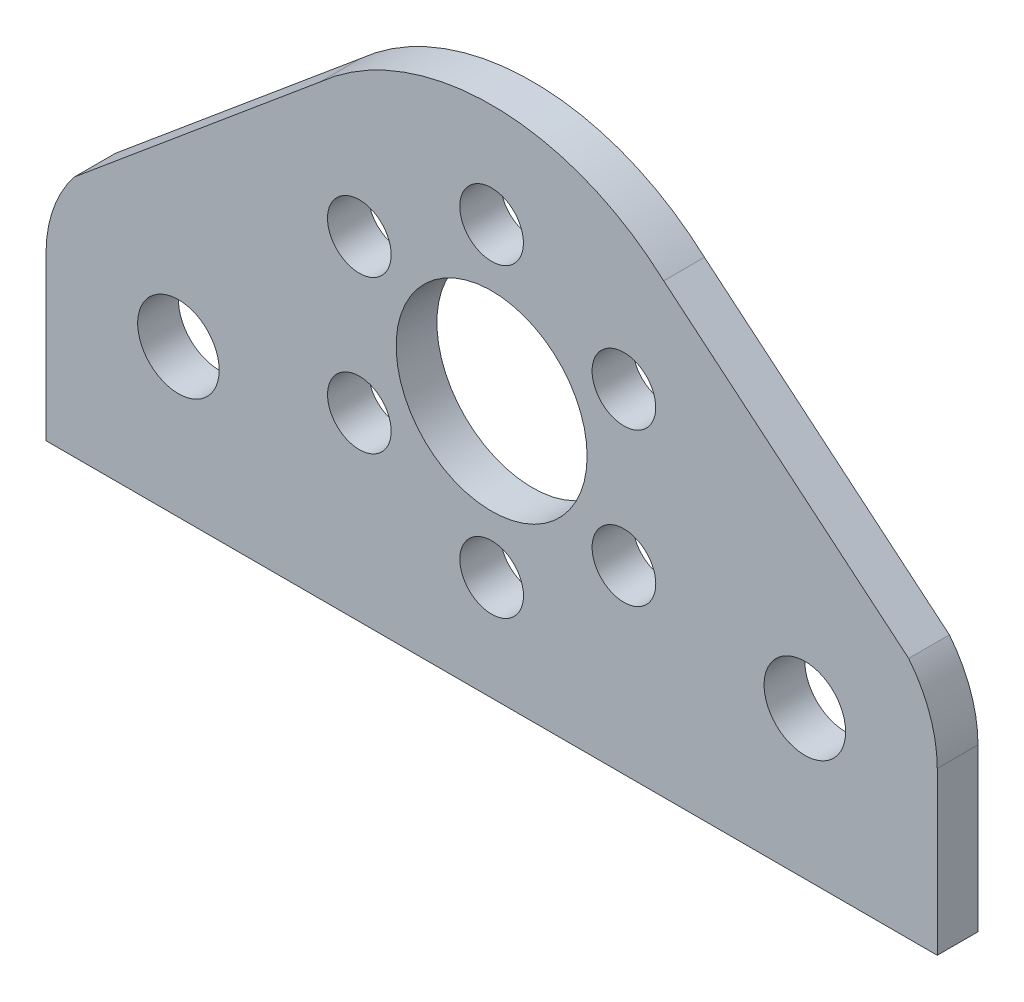
from build123d import *

# Parameters (mm, degrees)
CROQUIS1_R              = 3.75
CROQUIS1_R_2            = 1.249999997
CROQUIS1_R_3            = 1.25
CROQUIS1_R_4            = 1.250000007
CROQUIS1_R_5            = 1.6
SALIENTE_EXTRUIR1_DEPTH = 1.6


with BuildPart() as part:
    # Croquis1 → Saliente-Extruir1 (new body)
    with BuildSketch(Plane.XY):
        with BuildLine():
            Line((-17.5, -10.1), (17.5, -10.1))
            Line((17.5, -10.1), (17.5, -3.744033218))
            ThreePointArc((17.5, -3.744033218), (17.210606187, -2.056801008), (16.375506293, -0.562441789))
            Line((16.375506293, -0.562441789), (6.757496482, 7.466348016))
            ThreePointArc((6.757496482, 7.466348016), (0, 10.070258755), (-6.757496482, 7.466348016))
            Line((-6.757496482, 7.466348016), (-16.375506293, -0.562441789))
            ThreePointArc((-16.375506293, -0.562441789), (-17.210606187, -2.056801008), (-17.5, -3.744033218))
            Line((-17.5, -3.744033218), (-17.5, -10.1))
        make_face()
        Circle(CROQUIS1_R, mode=Mode.SUBTRACT)
        with Locations((-0.0012, 5.99880001)):
            Circle(CROQUIS1_R_2, mode=Mode.SUBTRACT)
        with Locations((5.194513192, 3.000439231)):
            Circle(CROQUIS1_R_3, mode=Mode.SUBTRACT)
        with Locations((5.195713192, -2.998360769)):
            Circle(CROQUIS1_R_3, mode=Mode.SUBTRACT)
        with Locations((0.0012, -5.9988)):
            Circle(CROQUIS1_R_3, mode=Mode.SUBTRACT)
        with Locations((-5.194513192, -3.00043923)):
            Circle(CROQUIS1_R_3, mode=Mode.SUBTRACT)
        with Locations((-5.195713248, 2.998360802)):
            Circle(CROQUIS1_R_4, mode=Mode.SUBTRACT)
        with Locations((12.3, -4.3)):
            Circle(CROQUIS1_R_5, mode=Mode.SUBTRACT)
        with Locations((-12.3, -4.3)):
            Circle(CROQUIS1_R_5, mode=Mode.SUBTRACT)
    extrude(amount=SALIENTE_EXTRUIR1_DEPTH)


solid = part.part
